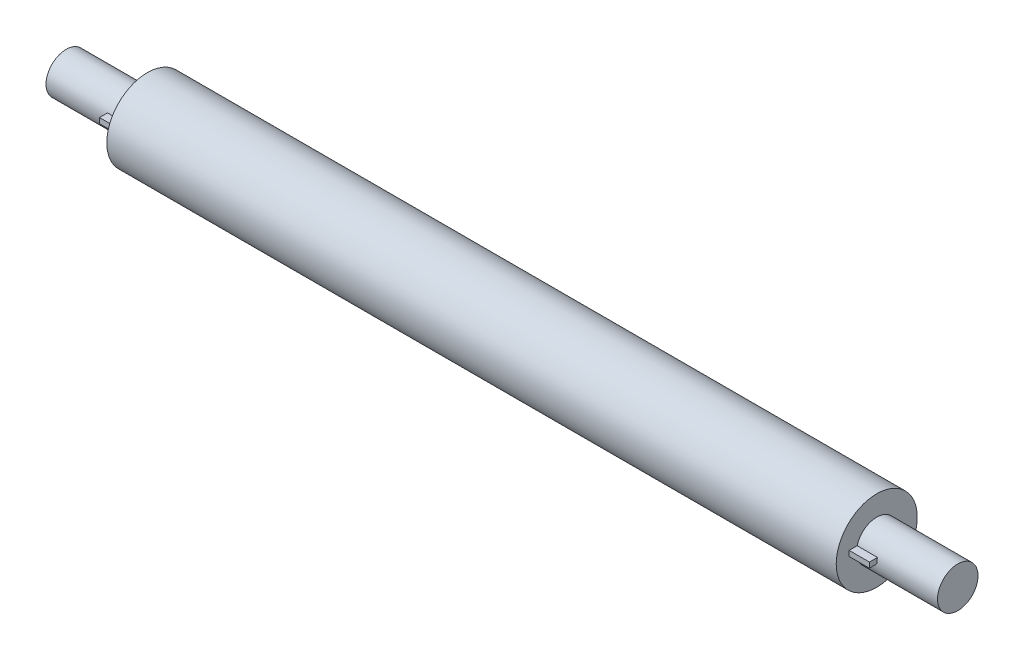
from build123d import *

# Parameters (mm, degrees)
BOSS_EXTRUDE1_DEPTH = 5


with BuildPart() as part:
    # Sketch1 → Revolve1 (revolve)
    with BuildSketch(Plane(origin=(0, 0, 0), x_dir=(1, 0, 0), z_dir=(0, 1, 0))):
        Polygon((-110, 0), (110, 0), (110, -5), (90, -5), (90, -10), (-90, -10), (-90, -5), (-110, -5), align=None)
    revolve(axis=Axis((-110, 0, 0), (1, 0, 0)))

    # Sketch2 → Boss-Extrude1 (add)
    with BuildSketch(Plane(origin=(90, 0, 0), x_dir=(0, 0, -1), z_dir=(1, 0, 0))):
        with BuildLine():
            Line((-5, 0), (-6.809348939, 0))
            Line((-6.809348939, 0), (-6.809348939, 1.307755756))
            Line((-6.809348939, 1.307755756), (-4.825948081, 1.307755756))
            ThreePointArc((-4.825948081, 1.307755756), (-4.956296016, 0.65964369), (-5, 0))
        make_face()
    boss_extrude1 = extrude(amount=BOSS_EXTRUDE1_DEPTH)

    # Mirror1: Boss-Extrude1 across plane
    add(boss_extrude1.mirror(Plane(origin=(0, 0, 0), x_dir=(0, 0, 1), z_dir=(1, 0, 0))))


solid = part.part
